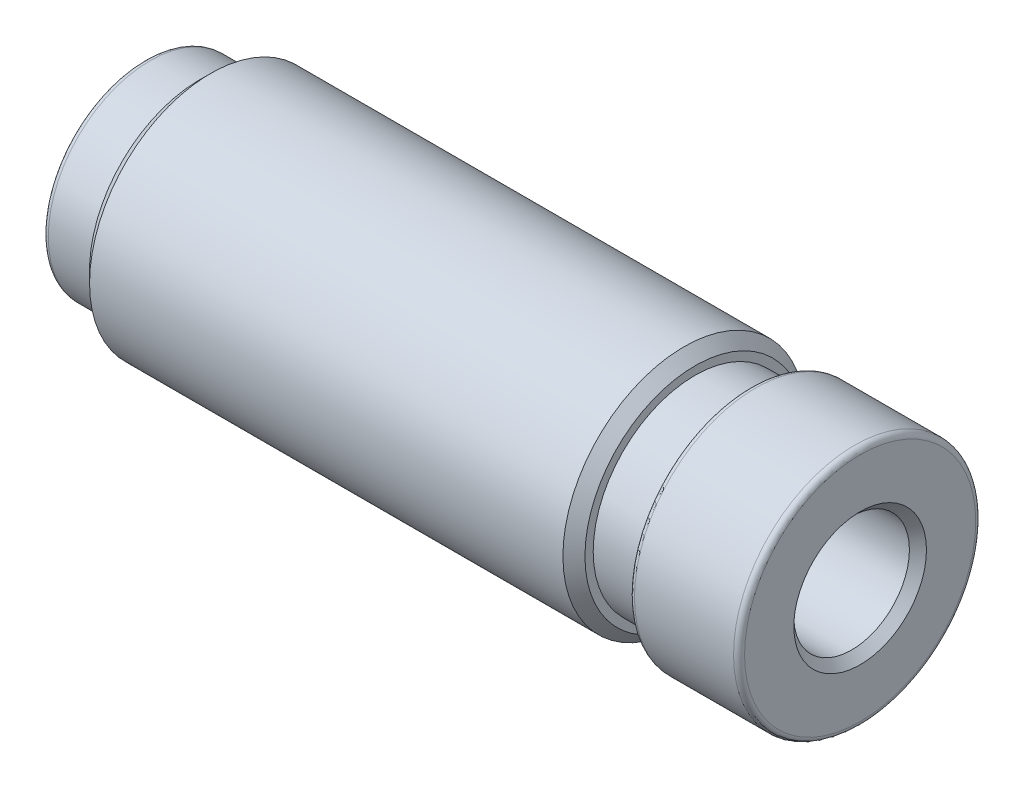
from build123d import *

# Parameters (mm, degrees)
FURO_ROSCADO_DE_M12X1_51_D           = 10.5
FURO_ROSCADO_DE_M12X1_51_DEPTH       = 41.5
FURO_ROSCADO_DE_M12X1_51_CSINK_D     = 12.05
FURO_ROSCADO_DE_M12X1_51_CSINK_ANGLE = 90
FURO_ROSCADO_DE_M12X1_51_TIP         = 3.15451825
FURO1_D                              = 9.8
FURO1_DEPTH                          = 25
CHANFRO1_SIZE                        = 1
CHANFRO3_SIZE                        = 1
FILETE1_R                            = 0.5
CHANFRO4_SIZE                        = 0.5


with BuildPart() as part:
    # Esboço1 → Revolução1 (revolve)
    with BuildSketch(Plane.XY, mode=Mode.PRIVATE) as revolu_o1_sk:
        Polygon((0, 0), (65, 0), (65, 11), (55, 11), (55, 9.25), (50, 9.25), (50, 11), (5, 11), (5, 9.25), (0, 9.25), align=None)
    revolve(revolu_o1_sk.sketch.rotate(Axis((0, 0, 0), (1, 0, 0)), 90), axis=Axis((0, 0, 0), (1, 0, 0)))

    # Furo roscado de M12x1.51
    with Locations(Plane(origin=(65, 0, 0), x_dir=(0, 0, -1), z_dir=(1, 0, 0))):
        with Locations((0, 0)):
            CounterSinkHole(FURO_ROSCADO_DE_M12X1_51_D / 2, FURO_ROSCADO_DE_M12X1_51_CSINK_D / 2, depth=FURO_ROSCADO_DE_M12X1_51_DEPTH, counter_sink_angle=FURO_ROSCADO_DE_M12X1_51_CSINK_ANGLE)
            with Locations((0, 0, -(FURO_ROSCADO_DE_M12X1_51_DEPTH + FURO_ROSCADO_DE_M12X1_51_TIP / 2))):  # 118° drill point
                Cone(0, FURO_ROSCADO_DE_M12X1_51_D / 2, FURO_ROSCADO_DE_M12X1_51_TIP, mode=Mode.SUBTRACT)

    # Furo1
    with Locations(Plane.ZY):
        with Locations((0, 0)):
            Hole(FURO1_D / 2, depth=FURO1_DEPTH)

    # Chanfro1
    chanfro1_edges = [part.edges().sort_by_distance(p)[0] for p in [
        (5, 0, -11),
    ]]
    chamfer(chanfro1_edges, length=CHANFRO1_SIZE)

    # Chanfro3
    chanfro3_edges = [part.edges().sort_by_distance(p)[0] for p in [
        (50, 0, -11),
    ]]
    chamfer(chanfro3_edges, length=CHANFRO3_SIZE)

    # Filete1
    filete1_edges = [part.edges().sort_by_distance(p)[0] for p in [
        (65, 0, -11),
        (0, 0, -9.25),
        (55, 0, -11),
    ]]
    fillet(filete1_edges, radius=FILETE1_R)

    # Chanfro4
    chanfro4_edges = [part.edges().sort_by_distance(p)[0] for p in [
        (0, 0, 4.9),
    ]]
    chamfer(chanfro4_edges, length=CHANFRO4_SIZE)


solid = part.part
